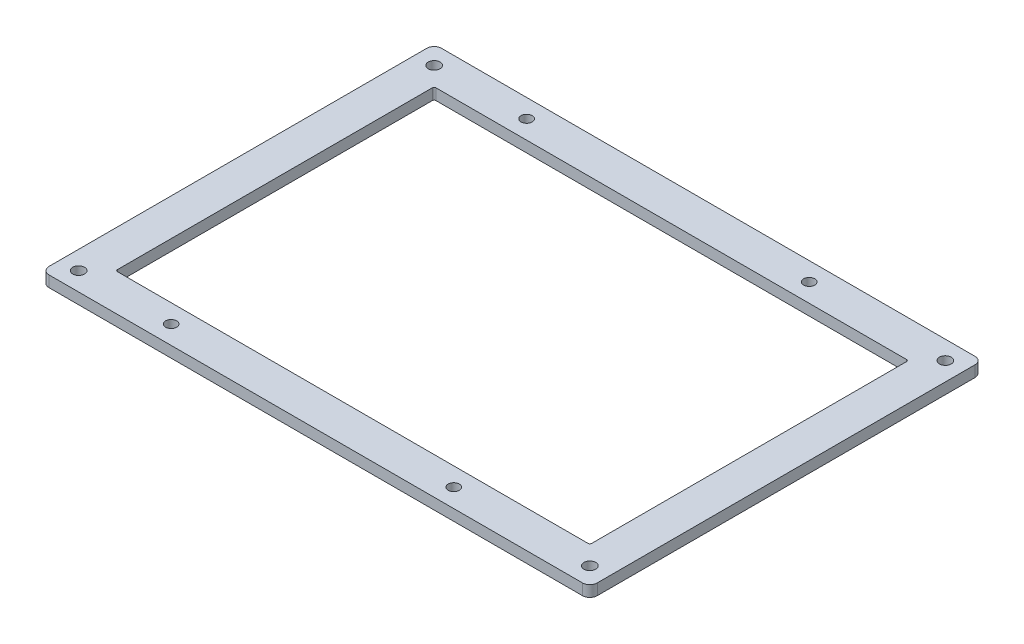
from build123d import *

# Parameters (mm, degrees)
SKETCH1_W           = 148.2
SKETCH1_H           = 106.1
SKETCH1_R           = 1.6
SKETCH1_W_2         = 128.2
SKETCH1_H_2         = 86.1
BOSS_EXTRUDE1_DEPTH = 3
FILLET1_R           = 2
FILLET2_R           = 0.5
CUT_EXTRUDE3_REACH  = 93.182
SKETCH4_R           = 1.5


with BuildPart() as part:
    # Sketch1 → Boss-Extrude1 (new body)
    with BuildSketch(Plane(origin=(0, 0, 0), x_dir=(1, 0, 0), z_dir=(0, 1, 0))):
        Rectangle(SKETCH1_W, SKETCH1_H)
        with Locations(Location((-69.1, 48.05, 0), (0, 0, 270))):
            Circle(SKETCH1_R, mode=Mode.SUBTRACT)
        with Locations(Location((-69.1, -48.05, 0), (0, 0, 90))):
            Circle(SKETCH1_R, mode=Mode.SUBTRACT)
        with Locations(Location((69.1, 48.05, 0), (0, 0, 90))):
            Circle(SKETCH1_R, mode=Mode.SUBTRACT)
        with Locations(Location((69.1, -48.05, 0), (0, 0, 270))):
            Circle(SKETCH1_R, mode=Mode.SUBTRACT)
        Rectangle(SKETCH1_W_2, SKETCH1_H_2, mode=Mode.SUBTRACT)
    extrude(amount=BOSS_EXTRUDE1_DEPTH)

    # Fillet1
    fillet1_edges = [part.edges().sort_by_distance(p)[0] for p in [
        (-74.1, 1.5, -53.05),
        (74.1, 1.5, -53.05),
        (74.1, 1.5, 53.05),
        (-74.1, 1.5, 53.05),
    ]]
    fillet(fillet1_edges, radius=FILLET1_R)

    # Fillet2
    fillet2_edges = [part.edges().sort_by_distance(p)[0] for p in [
        (64.1, 1.5, 43.05),
        (64.1, 1.5, -43.05),
        (-64.1, 1.5, -43.05),
        (-64.1, 1.5, 43.05),
    ]]
    fillet(fillet2_edges, radius=FILLET2_R)

    # Sketch4 → Cut-Extrude3 (cut, up to next)
    with BuildSketch(Plane(origin=(0, 3, 0), x_dir=(-1, 0, 0), z_dir=(0, 1, 0)), mode=Mode.PRIVATE) as cut_extrude3_sk1:
        with Locations(Location((-32.3, -48.05, 0), (0, 0, 90))):
            Circle(SKETCH4_R)
    cut_extrude3_tool1 = extrude(cut_extrude3_sk1.sketch, amount=-CUT_EXTRUDE3_REACH, mode=Mode.PRIVATE) & part.part
    # Sketch4 → Cut-Extrude3 (cut, up to next)
    with BuildSketch(Plane(origin=(0, 3, 0), x_dir=(-1, 0, 0), z_dir=(0, 1, 0)), mode=Mode.PRIVATE) as cut_extrude3_sk2:
        with Locations(Location((44.1, -48.05, 0), (0, 0, 90))):
            Circle(SKETCH4_R)
    cut_extrude3_tool2 = extrude(cut_extrude3_sk2.sketch, amount=-CUT_EXTRUDE3_REACH, mode=Mode.PRIVATE) & part.part
    # Sketch4 → Cut-Extrude3 (cut, up to next)
    with BuildSketch(Plane(origin=(0, 3, 0), x_dir=(-1, 0, 0), z_dir=(0, 1, 0)), mode=Mode.PRIVATE) as cut_extrude3_sk3:
        with Locations(Location((44.1, 48.05, 0), (0, 0, 90))):
            Circle(SKETCH4_R)
    cut_extrude3_tool3 = extrude(cut_extrude3_sk3.sketch, amount=-CUT_EXTRUDE3_REACH, mode=Mode.PRIVATE) & part.part
    # Sketch4 → Cut-Extrude3 (cut, up to next)
    with BuildSketch(Plane(origin=(0, 3, 0), x_dir=(-1, 0, 0), z_dir=(0, 1, 0)), mode=Mode.PRIVATE) as cut_extrude3_sk4:
        with Locations(Location((-32.3, 48.05, 0), (0, 0, 90))):
            Circle(SKETCH4_R)
    cut_extrude3_tool4 = extrude(cut_extrude3_sk4.sketch, amount=-CUT_EXTRUDE3_REACH, mode=Mode.PRIVATE) & part.part
    add(cut_extrude3_tool1.solids().sort_by_distance((32.3, 3, -48.05))[0], mode=Mode.SUBTRACT)
    add(cut_extrude3_tool2.solids().sort_by_distance((-44.1, 3, -48.05))[0], mode=Mode.SUBTRACT)
    add(cut_extrude3_tool3.solids().sort_by_distance((-44.1, 3, 48.05))[0], mode=Mode.SUBTRACT)
    add(cut_extrude3_tool4.solids().sort_by_distance((32.3, 3, 48.05))[0], mode=Mode.SUBTRACT)


solid = part.part
